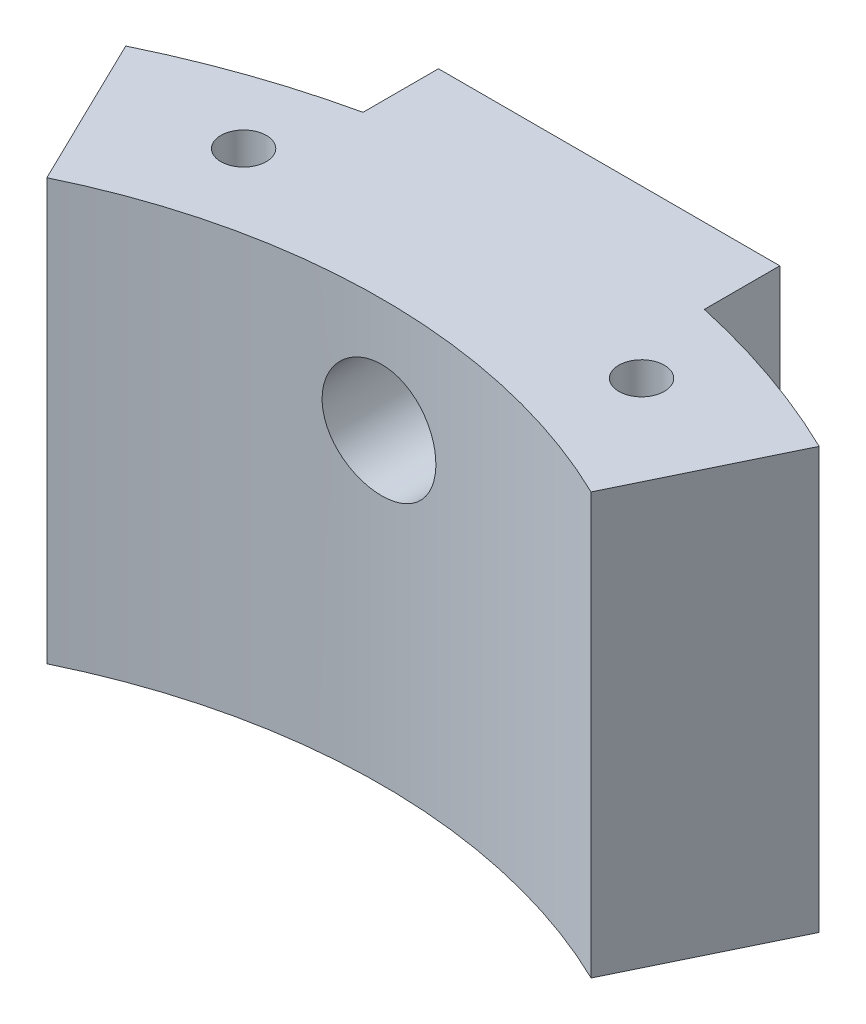
from build123d import *

# Parameters (mm, degrees)
BOSS_EXTRUDE1_DEPTH = 37
SKETCH2_R           = 2
CUT_EXTRUDE1_DEPTH  = 73.566185092
SKETCH3_W           = 30
SKETCH3_H           = 7.896551268
BOSS_EXTRUDE2_DEPTH = 48
SKETCH4_W           = 30
SKETCH4_H           = 6
CUT_EXTRUDE2_DEPTH  = 4
FILLET1_R           = 10
SKETCH5_R           = 5
CUT_EXTRUDE3_DEPTH  = 76.725712885
BOSS_EXTRUDE3_DEPTH = 1
CUT_EXTRUDE4_DEPTH  = 0.5


with BuildPart() as part:
    # Sketch1 → Boss-Extrude1 (new body)
    with BuildSketch(Plane(origin=(0, 0, 0), x_dir=(1, 0, 0), z_dir=(0, 1, 0))):
        with BuildLine():
            Line((0, 0), (6.55816832, -13.490382807))
            ThreePointArc((6.55816832, -13.490382807), (30.474828919, -7.985034321), (54.391489518, -13.490382807))
            Line((54.391489518, -13.490382807), (60.949657838, 0))
            ThreePointArc((60.949657838, 0), (30.474828919, 7.014965679), (0, 0))
        make_face()
    extrude(amount=BOSS_EXTRUDE1_DEPTH)

    # Sketch2 → Cut-Extrude1 (cut, through all)
    with BuildSketch(Plane(origin=(0, 37, 0), x_dir=(1, 0, 0), z_dir=(0, 1, 0))):
        with Locations(Location((12.985948873, -2.622359081, 0), (0, 0, 270))):
            Circle(SKETCH2_R)
        with Locations(Location((47.963708964, -2.622359081, 0), (0, 0, 90))):
            Circle(SKETCH2_R)
    extrude(amount=-CUT_EXTRUDE1_DEPTH, mode=Mode.SUBTRACT)

    # Sketch3 → Boss-Extrude2 (add)
    with BuildSketch(Plane(origin=(0, 37, 0), x_dir=(1, 0, 0), z_dir=(0, 1, 0))):
        with Locations((30.474828919, 8.066690045)):
            Rectangle(SKETCH3_W, SKETCH3_H)
    extrude(amount=-BOSS_EXTRUDE2_DEPTH)

    # Sketch4 → Cut-Extrude2 (cut)
    with BuildSketch(Plane.XY.offset(-4.118414411)):
        with Locations((30.474828919, -3)):
            Rectangle(SKETCH4_W, SKETCH4_H)
    extrude(amount=-CUT_EXTRUDE2_DEPTH, mode=Mode.SUBTRACT)

    # Fillet1
    fillet1_edges = [part.edges().sort_by_distance(p)[0] for p in [
        (15.474828919, -11, -8.066690045),
        (45.474828919, -11, -8.066690045),
    ]]
    fillet(fillet1_edges, radius=FILLET1_R)

    # Sketch5 → Cut-Extrude3 (cut, through all)
    with BuildSketch(Plane(origin=(0, 0, -12.014965679), x_dir=(-1, 0, 0), z_dir=(0, 0, -1))):
        with Locations((-30.474828919, 27)):
            Circle(SKETCH5_R)
    extrude(amount=-CUT_EXTRUDE3_DEPTH, mode=Mode.SUBTRACT)

    # Sketch7 → Boss-Extrude3 (add)
    with BuildSketch(Plane(origin=(0, 0, -12.014965679), x_dir=(-1, 0, 0), z_dir=(0, 0, -1))):
        with BuildLine():
            Line((-21.536068007, 1.453872129), (-26.199769352, 0))
            ThreePointArc((-26.199769352, 0), (-24.751375622, 3.560871216), (-21.536068007, 1.453872129))
        make_face()
        with BuildLine():
            Line((-34.426020337, 3.673663851), (-38.960174422, 5.664158065))
            ThreePointArc((-38.960174422, 5.664158065), (-37.895872331, 1.929105477), (-34.426020337, 3.673663851))
        make_face()
    extrude(amount=BOSS_EXTRUDE3_DEPTH)

    # Sketch8 → Cut-Extrude4 (cut)
    with BuildSketch(Plane(origin=(0, 0, -13.014965679), x_dir=(-1, 0, 0), z_dir=(0, 0, -1))):
        with BuildLine():
            Line((-23.022731531, 0.990416495), (-25.036897729, 0.362516061))
            ThreePointArc((-25.036897729, 0.362516061), (-24.475304572, 2.105499822), (-23.022731531, 0.990416495))
        make_face()
        with BuildLine():
            Line((-35.750767501, 4.255228023), (-37.89390211, 5.196064386))
            ThreePointArc((-37.89390211, 5.196064386), (-37.451768412, 3.29185708), (-35.750767501, 4.255228023))
        make_face()
    extrude(amount=-CUT_EXTRUDE4_DEPTH, mode=Mode.SUBTRACT)


solid = part.part
